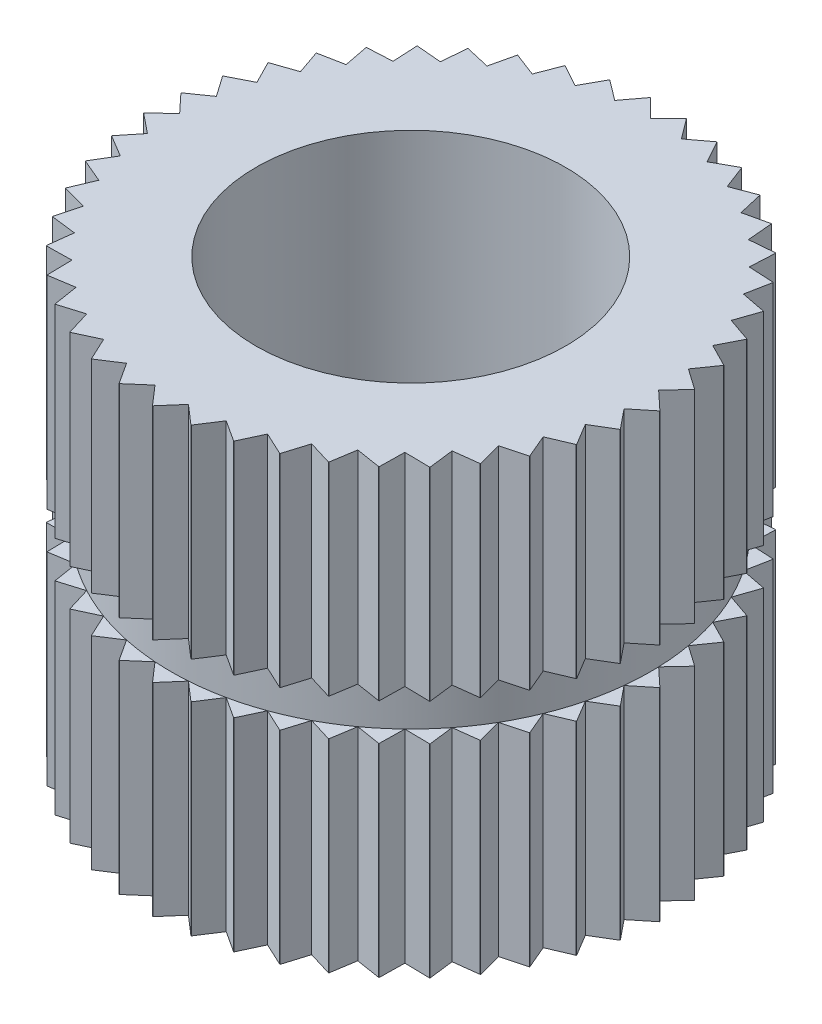
from build123d import *

# Parameters (mm, degrees)
CUT_EXTRUDE1_DEPTH    = 8.778174593
CIRPATTERN1_COUNT     = 45
M5X0_8_TAPPED_HOLE1_D = 4.2


with BuildPart() as part:
    # Sketch1 → Revolve1 (revolve)
    with BuildSketch(Plane.XY):
        Polygon((0, 0), (0, 6), (-3.5, 6), (-3.5, 3.25), (-3.25, 3.25), (-3.25, 2.75), (-3.5, 2.75), (-3.5, 0), align=None)
    revolve(axis=Axis((0, 0, 0), (0, 1, 0)))

    # Sketch2 → Cut-Extrude1 (cut, through all)
    with BuildSketch(Plane(origin=(0, 6, 0), x_dir=(1, 0, 0), z_dir=(0, 1, 0))):
        with BuildLine():
            Line((-0.241648065, 3.491648065), (0, 3.25))
            Line((0, 3.25), (0.241648065, 3.491648065))
            ThreePointArc((0.241648065, 3.491648065), (0, 3.5), (-0.241648065, 3.491648065))
        make_face()
    cut_extrude1 = extrude(amount=-CUT_EXTRUDE1_DEPTH, mode=Mode.SUBTRACT)

    # CirPattern1: Cut-Extrude1 ×45 about axis
    cirpattern1_axis = Axis((0, 6.3, 0), (0, -1, 0))
    for i in range(1, CIRPATTERN1_COUNT):
        add(cut_extrude1.rotate(cirpattern1_axis, i * 360 / CIRPATTERN1_COUNT), mode=Mode.SUBTRACT)

    # M5x0.8 Tapped Hole1 (through all)
    with Locations(Plane(origin=(0, 6, 0), x_dir=(1, 0, 0), z_dir=(0, 1, 0))):
        with Locations((0, 0)):
            Hole(M5X0_8_TAPPED_HOLE1_D / 2)


solid = part.part
